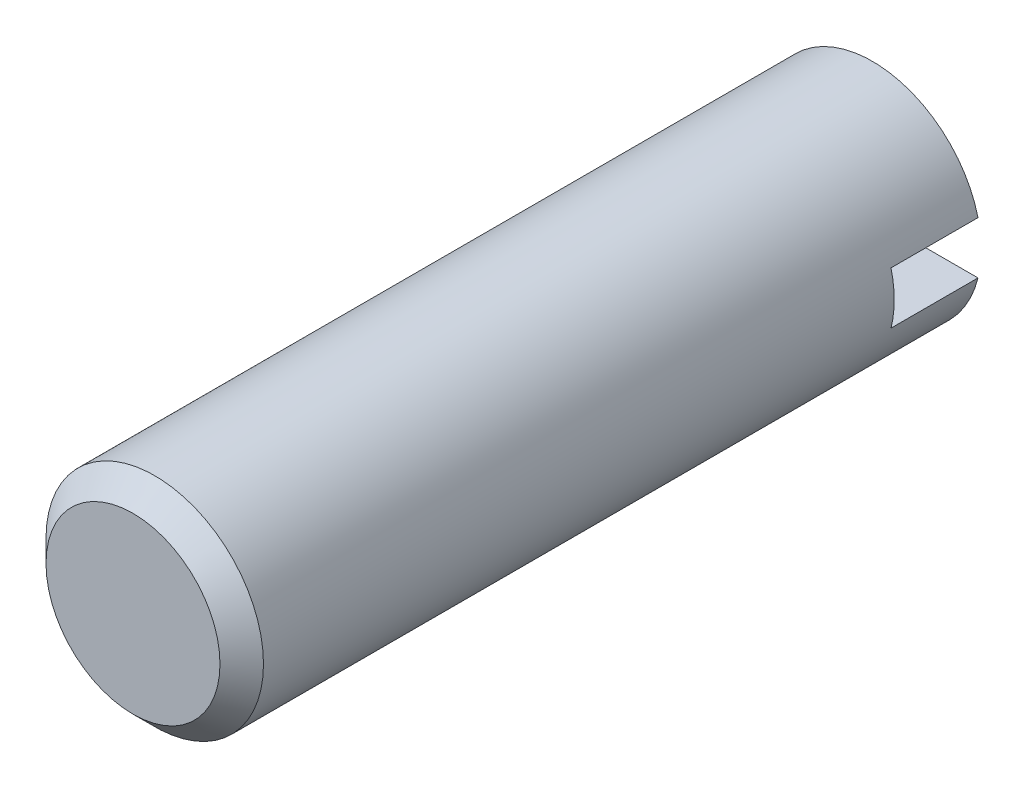
from build123d import *

# Parameters (mm, degrees)
SKETCH2_W          = 5.424806346
SKETCH2_H          = 1.2
CUT_EXTRUDE1_DEPTH = 2


with BuildPart() as part:
    # Sketch1 → Revolve1 (revolve)
    with BuildSketch(Plane(origin=(0, 0, 0), x_dir=(0, 0, -1), z_dir=(1, 0, 0)), mode=Mode.PRIVATE) as revolve1_sk:
        Polygon((0, 0), (0, 2), (0.5, 2.5), (17, 2.5), (17, 0), align=None)
    revolve(revolve1_sk.sketch.rotate(Axis((0, 0, 0), (0, 0, -1)), 90), axis=Axis((0, 0, 0), (0, 0, -1)))

    # Sketch2 → Cut-Extrude1 (cut)
    with BuildSketch(Plane(origin=(0, 0, -17), x_dir=(-1, 0, 0), z_dir=(0, 0, -1))):
        Rectangle(SKETCH2_W, SKETCH2_H)
    extrude(amount=-CUT_EXTRUDE1_DEPTH, mode=Mode.SUBTRACT)


solid = part.part
